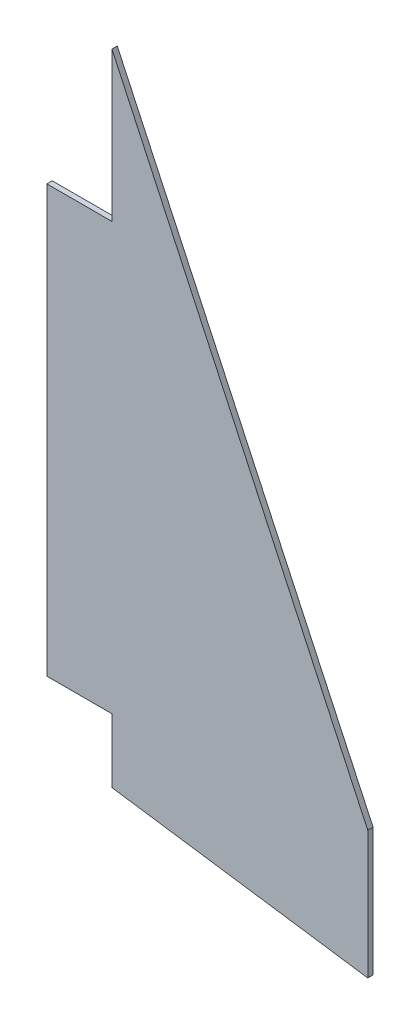
from build123d import *

# Parameters (mm, degrees)
BOSS_EXTRUDE1_DEPTH = 3.175
SKETCH2_W           = 38.735
SKETCH2_H           = 254
BOSS_EXTRUDE2_DEPTH = 3.175


with BuildPart() as part:
    # Sketch1 → Boss-Extrude1 (new body)
    with BuildSketch(Plane.XY):
        Polygon((0, 0), (0, 381), (152.4, 54.177145314), (152.4, -22.022854686), align=None)
    extrude(amount=BOSS_EXTRUDE1_DEPTH)

    # Sketch2 → Boss-Extrude2 (add)
    with BuildSketch(Plane.XY.offset(3.175)):
        with Locations((-19.3675, 165.1)):
            Rectangle(SKETCH2_W, SKETCH2_H)
    extrude(amount=-BOSS_EXTRUDE2_DEPTH)


solid = part.part
